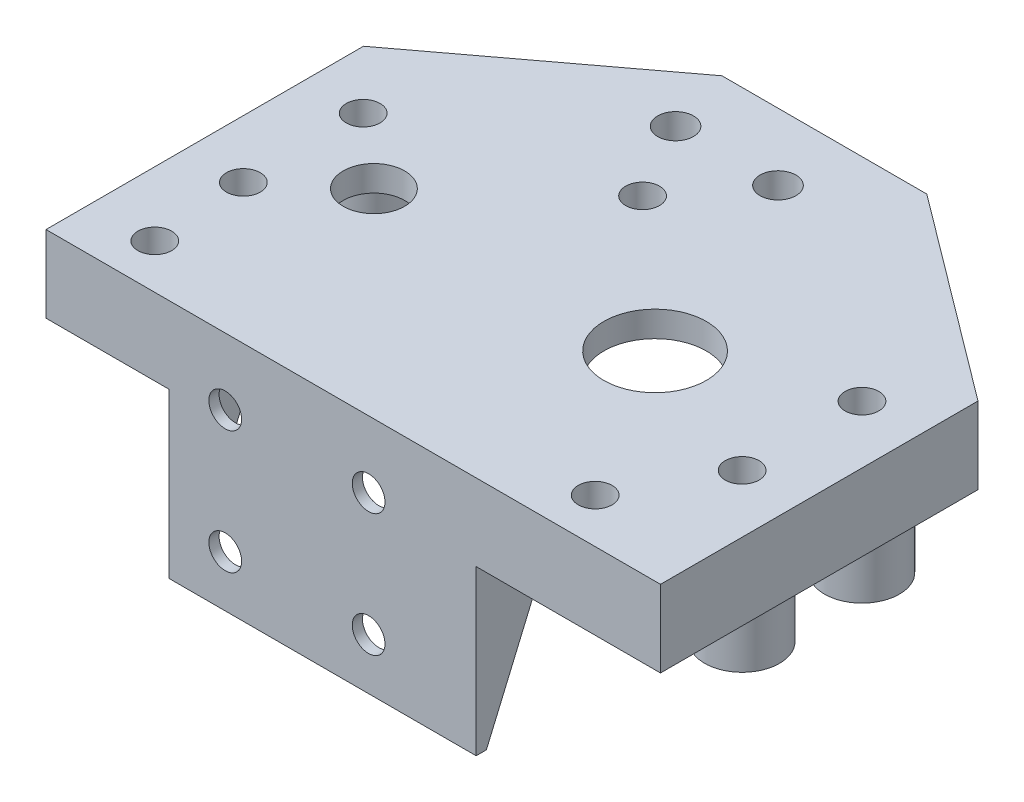
from build123d import *
from build123d.topology import SkipClean

# Parameters (mm, degrees)
SKETCH_1_R          = 1.65
SKETCH_1_R_2        = 5
SKETCH_1_R_3        = 3
SKETCH_1_R_4        = 1.75
EXTRUDE_1_DEPTH     = 2.5
EXTRUDE_START       = 12
SKETCH_2_R          = 3.65
SKETCH_2_R_2        = 1.65
EXTRUDE_2_DEPTH     = 12
EXTRUDE_START_2     = 2.5
SKETCH_4_R          = 3.25
SKETCH_4_R_2        = 1.75
EXTRUDE_3_DEPTH     = 2.5
EXTRUDE_5_DEPTH     = 5
SKETCH_10_W         = 30
SKETCH_10_H         = 16
EXTRUDE_7_DEPTH     = 1
EXTRUDE_8_DEPTH     = 0.5
EXTRUDE_9_DEPTH     = 1
EXTRUDE_10_DEPTH    = 1
SKETCH_15_R         = 1.6
CUT_EXTRUDE_1_DEPTH = 1
SKETCH_16_R         = 1.65
CUT_EXTRUDE_2_DEPTH = 10


with BuildPart() as part:
    # 草图1 → 凸台-拉伸1 (new body)
    with BuildSketch(Plane(origin=(0, 0, 0), x_dir=(1, 0, 0), z_dir=(0, 1, 0))):
        Polygon((0, 0), (60, 0), (60, 31), (40, 46), (20, 46), (0, 31), align=None)
        with Locations(Location((5.65, 13.619787101, 0), (0, 0, 270))):
            Circle(SKETCH_1_R, mode=Mode.SUBTRACT)
        with Locations(Location((54.35, 13.619787101, 0), (0, 0, 270))):
            Circle(SKETCH_1_R, mode=Mode.SUBTRACT)
        with Locations(Location((5.65, 25.319787101, 0), (0, 0, 270))):
            Circle(SKETCH_1_R, mode=Mode.SUBTRACT)
        with Locations(Location((54.35, 25.319787101, 0), (0, 0, 270))):
            Circle(SKETCH_1_R, mode=Mode.SUBTRACT)
        with Locations(Location((40, 19.469787101, 0), (0, 0, 270))):
            Circle(SKETCH_1_R_2, mode=Mode.SUBTRACT)
        with Locations(Location((12.55, 19.469787101, 0), (0, 0, 270))):
            Circle(SKETCH_1_R_3, mode=Mode.SUBTRACT)
        with Locations(Location((26.28, 31.969787101, 0), (0, 0, 270))):
            Circle(SKETCH_1_R, mode=Mode.SUBTRACT)
        with Locations(Location((22, 39.469787101, 0), (0, 0, 270))):
            Circle(SKETCH_1_R_4, mode=Mode.SUBTRACT)
        with Locations(Location((32, 39.469787101, 0), (0, 0, 90))):
            Circle(SKETCH_1_R_4, mode=Mode.SUBTRACT)
    extrude(amount=EXTRUDE_1_DEPTH)

    # 草图2 → 凸台-拉伸2 (add)
    # profile 1 of 4: a face of its own
    with SkipClean():  # the faces are left unmerged after this step: merging them gives an invalid solid
        with BuildSketch(Plane.XZ.offset(EXTRUDE_START)):
            with Locations(Location((5.65, -13.619787101, 0), (0, 0, 270))):
                Circle(SKETCH_2_R)
            with Locations(Location((5.65, -13.619787101, 0), (0, 0, 270))):
                Circle(SKETCH_2_R_2, mode=Mode.SUBTRACT)
        # profile 2 of 4: a face of its own
        with BuildSketch(Plane.XZ.offset(EXTRUDE_START)):
            with Locations(Location((5.65, -25.319787101, 0), (0, 0, 270))):
                Circle(SKETCH_2_R)
            with Locations(Location((5.65, -25.319787101, 0), (0, 0, 270))):
                Circle(SKETCH_2_R_2, mode=Mode.SUBTRACT)
        # profile 3 of 4: a face of its own
        with BuildSketch(Plane.XZ.offset(EXTRUDE_START)):
            with Locations(Location((54.35, -13.619787101, 0), (0, 0, 270))):
                Circle(SKETCH_2_R)
            with Locations(Location((54.35, -13.619787101, 0), (0, 0, 270))):
                Circle(SKETCH_2_R_2, mode=Mode.SUBTRACT)
        # profile 4 of 4: a face of its own
        with BuildSketch(Plane.XZ.offset(EXTRUDE_START)):
            with Locations(Location((54.35, -25.319787101, 0), (0, 0, 270))):
                Circle(SKETCH_2_R)
            with Locations(Location((54.35, -25.319787101, 0), (0, 0, 270))):
                Circle(SKETCH_2_R_2, mode=Mode.SUBTRACT)
        extrude(amount=-EXTRUDE_2_DEPTH)

    # 草图4 → 凸台-拉伸3 (add)
    # profile 1 of 2: a face of its own
    with SkipClean():  # the faces are left unmerged after this step: merging them gives an invalid solid
        with BuildSketch(Plane.XZ.offset(EXTRUDE_START_2)):
            with Locations(Location((22, -39.469787101, 0), (0, 0, 270))):
                Circle(SKETCH_4_R)
            with Locations(Location((22, -39.469787101, 0), (0, 0, 270))):
                Circle(SKETCH_4_R_2, mode=Mode.SUBTRACT)
        # profile 2 of 2: a face of its own
        with BuildSketch(Plane.XZ.offset(EXTRUDE_START_2)):
            with Locations(Location((32, -39.469787101, 0), (0, 0, 270))):
                Circle(SKETCH_4_R)
            with Locations(Location((32, -39.469787101, 0), (0, 0, 270))):
                Circle(SKETCH_4_R_2, mode=Mode.SUBTRACT)
        extrude(amount=-EXTRUDE_3_DEPTH)

    # 草图6 → 凸台-拉伸5 (add)
    with SkipClean():  # the faces are left unmerged after this step: merging them gives an invalid solid
        with BuildSketch(Plane.XZ):
            Polygon((0, -31), (20, -46), (40, -46), (60, -31), (60, 0), (0, 0), align=None)
            Polygon((1, -1), (1, -30.5), (20.333333333, -45), (39.666666667, -45), (59, -30.5), (59, -1), align=None, mode=Mode.SUBTRACT)
        extrude(amount=EXTRUDE_5_DEPTH)

    # 草图10 → 凸台-拉伸7 (add)
    with SkipClean():  # the faces are left unmerged after this step: merging them gives an invalid solid
        with BuildSketch(Plane.XY):
            with Locations((27, -13)):
                Rectangle(SKETCH_10_W, SKETCH_10_H)
        extrude(amount=-EXTRUDE_7_DEPTH)

    # 草图11 → 凸台-拉伸8 (add, symmetric)
    with SkipClean():  # the faces are left unmerged after this step: merging them gives an invalid solid
        with BuildSketch(Plane.ZY.offset(-24)):
            Polygon((-1, -21), (-1, 0), (-9.969787101, 0), align=None)
        extrude(amount=EXTRUDE_8_DEPTH, both=True)

    # 草图12 → 凸台-拉伸9 (add)
    with SkipClean():  # the faces are left unmerged after this step: merging them gives an invalid solid
        with BuildSketch(Plane.ZY.offset(-12)):
            Polygon((-1, -21), (-1, 0), (-9.969787101, 0), align=None)
        extrude(amount=-EXTRUDE_9_DEPTH)

    # 草图13 → 凸台-拉伸10 (add)
    with SkipClean():  # the faces are left unmerged after this step: merging them gives an invalid solid
        with BuildSketch(Plane(origin=(42, 0, 0), x_dir=(0, 0, -1), z_dir=(1, 0, 0))):
            Polygon((1, -21), (9.969787101, 0), (1, 0), align=None)
        extrude(amount=-EXTRUDE_10_DEPTH)

    # 草图15 → 切除-拉伸1 (cut)
    with SkipClean():  # the faces are left unmerged after this step: merging them gives an invalid solid
        with BuildSketch(Plane.XY):
            with Locations((17.5, -16)):
                Circle(SKETCH_15_R)
            with Locations((17.5, -4)):
                Circle(SKETCH_15_R)
            with Locations((31.5, -16)):
                Circle(SKETCH_15_R)
            with Locations((31.5, -4)):
                Circle(SKETCH_15_R)
        extrude(amount=-CUT_EXTRUDE_1_DEPTH, mode=Mode.SUBTRACT)

    # 草图16 → 切除-拉伸2 (cut)
    with SkipClean():  # the faces are left unmerged after this step: merging them gives an invalid solid
        with BuildSketch(Plane(origin=(0, 2.5, 0), x_dir=(1, 0, 0), z_dir=(0, 1, 0))):
            with Locations(Location((6.27, 4.35, 0), (0, 0, 270))):
                Circle(SKETCH_16_R)
            with Locations(Location((49.27, 4.35, 0), (0, 0, 270))):
                Circle(SKETCH_16_R)
        extrude(amount=-CUT_EXTRUDE_2_DEPTH, mode=Mode.SUBTRACT)


solid = part.part
